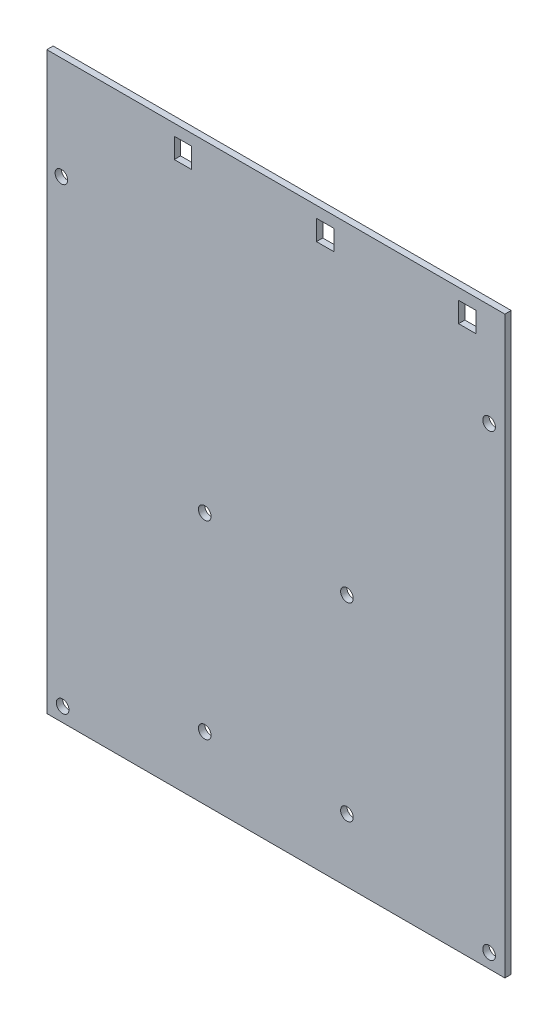
from build123d import *

# Parameters (mm, degrees)
SZKIC1_W                    = 145
SZKIC1_H                    = 182
DODANIE_WYCI_GNI_CIE1_DEPTH = 2
SZKIC2_R                    = 2
WYTNIJ_WYCI_GNI_CIE1_DEPTH  = 32
SZKIC3_W                    = 5.5
SZKIC3_H                    = 6.4
WYTNIJ_WYCI_GNI_CIE2_DEPTH  = 32
SZKIC4_R                    = 2
WYTNIJ_WYCI_GNI_CIE3_DEPTH  = 12


with BuildPart() as part:
    # Szkic1 → Dodanie-wyciągnięcie1 (new body)
    with BuildSketch(Plane.XY):
        Rectangle(SZKIC1_W, SZKIC1_H)
    extrude(amount=DODANIE_WYCI_GNI_CIE1_DEPTH)

    # Szkic2 → Wytnij-wyciągnięcie1 (cut)
    with BuildSketch(Plane(origin=(0, 0, 0), x_dir=(-1, 0, 0), z_dir=(0, 0, -1))):
        with Locations((-22.5, -11)):
            Circle(SZKIC2_R)
        with Locations((-22.5, -71)):
            Circle(SZKIC2_R)
        with Locations((22.5, -71)):
            Circle(SZKIC2_R)
        with Locations((22.5, -11)):
            Circle(SZKIC2_R)
    extrude(amount=-WYTNIJ_WYCI_GNI_CIE1_DEPTH, mode=Mode.SUBTRACT)

    # Szkic3 → Wytnij-wyciągnięcie2 (cut)
    with BuildSketch(Plane(origin=(0, 0, 0), x_dir=(-1, 0, 0), z_dir=(0, 0, -1))):
        with Locations((-15.6, 84.25)):
            Rectangle(SZKIC3_W, SZKIC3_H)
        with Locations((29.4, 84.25)):
            Rectangle(SZKIC3_W, SZKIC3_H)
        with Locations((-60.6, 84.25)):
            Rectangle(SZKIC3_W, SZKIC3_H)
    extrude(amount=-WYTNIJ_WYCI_GNI_CIE2_DEPTH, mode=Mode.SUBTRACT)

    # Szkic4 → Wytnij-wyciągnięcie3 (cut)
    with BuildSketch(Plane(origin=(0, 0, 0), x_dir=(-1, 0, 0), z_dir=(0, 0, -1))):
        with Locations((67.5, -86.5)):
            Circle(SZKIC4_R)
        with Locations((-67.5, -86.5)):
            Circle(SZKIC4_R)
        with Locations((-67.5, 58.5)):
            Circle(SZKIC4_R)
        with Locations((67.878744236, 58.5)):
            Circle(SZKIC4_R)
    extrude(amount=-WYTNIJ_WYCI_GNI_CIE3_DEPTH, mode=Mode.SUBTRACT)


solid = part.part
